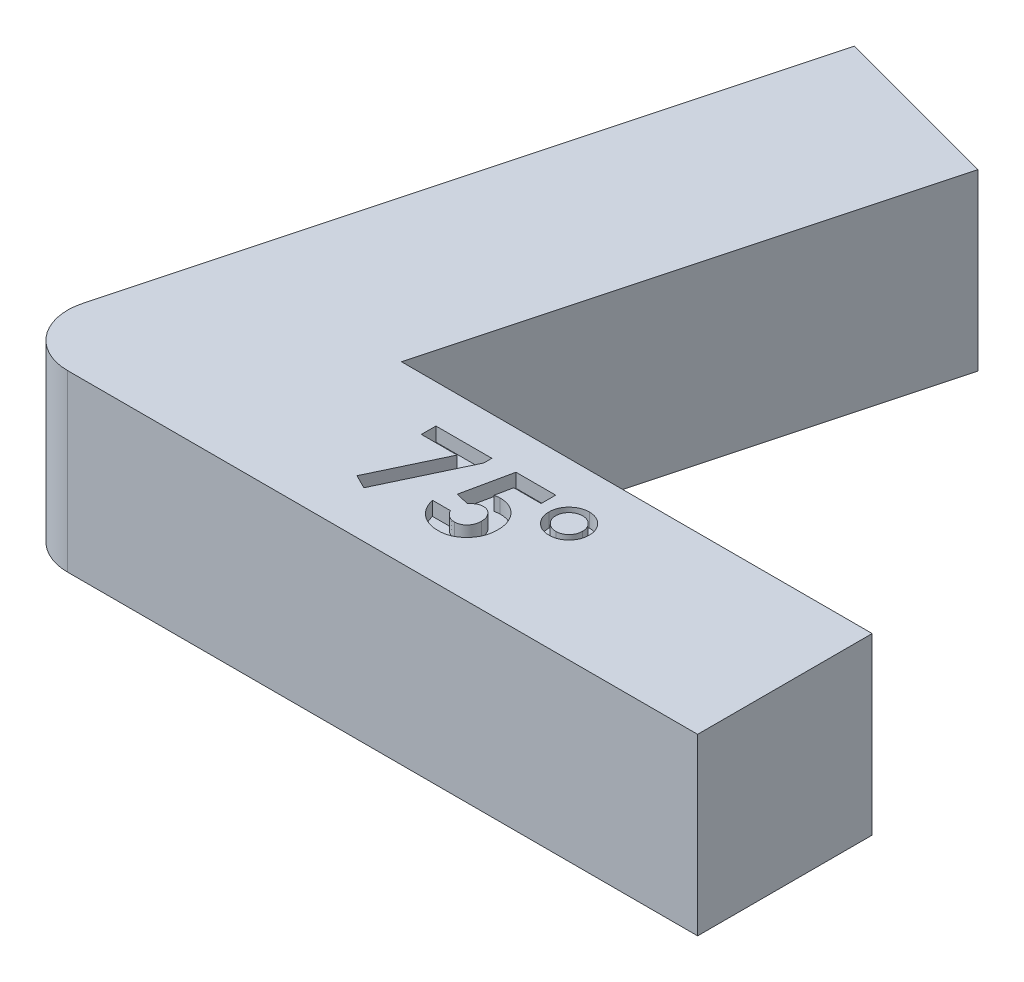
from build123d import *

# Parameters (mm, degrees)
BOSS_EXTRUDE1_DEPTH = 10
CUT_EXTRUDE1_DEPTH  = 0.8
FILLET1_R           = 3


with BuildPart() as part:
    # Sketch1 → Boss-Extrude1 (new body)
    with BuildSketch(Plane(origin=(0, 0, 0), x_dir=(1, 0, 0), z_dir=(0, 1, 0))):
        Polygon((0, 0), (10.352761804, 38.637033052), (20.012020067, 36.048842601), (13.032253728, 10), (40, 10), (40, 0), align=None)
    extrude(amount=BOSS_EXTRUDE1_DEPTH)

    # Sketch2 → Cut-Extrude1 (cut)
    # profile 1 of 3: a face of its own
    with BuildSketch(Plane(origin=(0, 10, 0), x_dir=(1, 0, 0), z_dir=(0, 1, 0))):
        Polygon((17.209062597, 7.800304966), (20.414190802, 7.800304966), (20.414190802, 7.334559774), (18.208661956, 2.672099838), (17.41338952, 3.072740864), (19.256338238, 6.966971633), (17.209062597, 6.966971633), align=None)
    # profile 2 of 3: a face of its own
    with BuildSketch(Plane(origin=(0, 10, 0), x_dir=(1, 0, 0), z_dir=(0, 1, 0))):
        with BuildLine():
            Line((21.791394328, 7.800304966), (24.068036956, 7.800304966))
            Line((24.068036956, 7.800304966), (24.068036956, 6.966971633))
            Line((24.068036956, 6.966971633), (22.502532148, 6.966971633))
            Line((22.502532148, 6.966971633), (22.307219648, 6.021458812))
            add(Edge.make_bspline(
                [(22.307219648, 6.021458812), (22.333833772, 6.028871182), (22.386322293, 6.043489897), (22.465396314, 6.058150619), (22.542030061, 6.067653234), (22.592316657, 6.068920756), (22.61671484, 6.069535735)],
                knots=[0, 0, 0, 0, 1.05461699, 2.079921384, 3.068411212, 4, 4, 4, 4], degree=3))
            add(Edge.make_bspline(
                [(22.61671484, 6.069535735), (22.669881037, 6.068317463), (22.774683324, 6.065915979), (22.927995769, 6.043118066), (23.074801493, 6.007212044), (23.214651253, 5.956002648), (23.347408434, 5.889352297), (23.473233965, 5.808724056), (23.592282275, 5.713976312), (23.702438566, 5.605049745), (23.803654767, 5.485445908), (23.89165648, 5.356081703), (23.966815436, 5.218801737), (24.02659427, 5.072752682), (24.073776823, 4.918851823), (24.107871989, 4.757000537), (24.128034164, 4.587007005), (24.13075291, 4.471032572), (24.13213952, 4.411883492)],
                knots=[0, 0, 0, 0, 1.01440847, 1.999622559, 2.951875003, 3.895578053, 4.836219714, 5.782137149, 6.743708247, 7.735272588, 8.734977101, 9.730283169, 10.717124674, 11.717316708, 12.737475749, 13.78628267, 14.87096371, 16, 16, 16, 16], degree=3))
            add(Edge.make_bspline(
                [(24.13213952, 4.411883492), (24.13044506, 4.352062933), (24.127101396, 4.234019483), (24.105287051, 4.060453858), (24.066784339, 3.894217172), (24.013897012, 3.734864413), (23.944221345, 3.583566786), (23.860426819, 3.438756962), (23.761096694, 3.301509816), (23.647205741, 3.173232299), (23.523391335, 3.055984185), (23.39155822, 2.952840795), (23.252632563, 2.866046468), (23.106611012, 2.795901979), (22.95433134, 2.740404907), (22.795747327, 2.700005688), (22.630088277, 2.67683898), (22.517627305, 2.673696911), (22.46046484, 2.672099838)],
                knots=[0, 0, 0, 0, 1.06808661, 2.107647099, 3.116961351, 4.110378221, 5.100014249, 6.085620622, 7.093190682, 8.119403071, 9.144090782, 10.133780668, 11.103064255, 12.062861538, 13.020824475, 13.992378307, 14.979551724, 16, 16, 16, 16], degree=3))
            add(Edge.make_bspline(
                [(22.46046484, 2.672099838), (22.40934615, 2.673406343), (22.308529394, 2.675983045), (22.160030738, 2.691820813), (22.016861544, 2.719822135), (21.879781883, 2.760347298), (21.747349448, 2.810224522), (21.621095195, 2.872605417), (21.500325337, 2.946302167), (21.385382813, 3.029969803), (21.278135276, 3.12421815), (21.180251089, 3.227389204), (21.091137648, 3.338182545), (21.012701841, 3.457965025), (20.94518954, 3.586559674), (20.885318255, 3.722450972), (20.836313008, 3.86705806), (20.811444257, 3.967307727), (20.798806187, 4.018253684)],
                knots=[0, 0, 0, 0, 1.054957082, 2.080596141, 3.077793124, 4.061112343, 5.027190972, 5.994718051, 6.962465889, 7.943658696, 8.924948258, 9.904494768, 10.875059, 11.855380583, 12.854004648, 13.869083016, 14.917087635, 16, 16, 16, 16], degree=3))
            Line((20.798806187, 4.018253684), (21.824447212, 4.018253684))
            add(Edge.make_bspline(
                [(21.824447212, 4.018253684), (21.843195955, 3.982950211), (21.879631997, 3.914341939), (21.948941404, 3.823254149), (22.026528884, 3.745578396), (22.111694558, 3.680555769), (22.204990244, 3.631841924), (22.302614321, 3.594899597), (22.405793198, 3.573551995), (22.476062568, 3.570883333), (22.511546571, 3.569535735)],
                knots=[0, 0, 0, 0, 1.104910296, 2.147267069, 3.153527244, 4.136738762, 5.099945312, 6.05603338, 7.018353, 8, 8, 8, 8], degree=3))
            add(Edge.make_bspline(
                [(22.511546571, 3.569535735), (22.536278445, 3.570466263), (22.584938824, 3.572297092), (22.656632197, 3.581982635), (22.725066672, 3.600326836), (22.790751041, 3.625729288), (22.853861751, 3.657409016), (22.913494087, 3.697402609), (22.970685545, 3.743436716), (23.024565438, 3.79626101), (23.073365091, 3.855147811), (23.116157049, 3.918425693), (23.15441896, 3.984688608), (23.182760143, 4.056561396), (23.205969175, 4.13189791), (23.223061245, 4.211266437), (23.233275684, 4.294759672), (23.234221268, 4.351758164), (23.234703623, 4.380833812)],
                knots=[0, 0, 0, 0, 0.978869489, 1.925942215, 2.855067702, 3.774946051, 4.70828698, 5.642468714, 6.60995405, 7.609372294, 8.622401667, 9.629904756, 10.629323, 11.642352373, 12.678539694, 13.745912462, 14.850161547, 16, 16, 16, 16], degree=3))
            add(Edge.make_bspline(
                [(23.234703623, 4.380833812), (23.234143795, 4.409234549), (23.233054076, 4.464517273), (23.224039706, 4.545692113), (23.207913173, 4.622712346), (23.185940632, 4.696167889), (23.157813157, 4.765612684), (23.123439502, 4.8314601), (23.08267282, 4.893377303), (23.035294242, 4.950103719), (22.984770214, 5.002134801), (22.930491174, 5.04764077), (22.872946146, 5.085407566), (22.813923272, 5.118379077), (22.75106657, 5.142375024), (22.685789435, 5.158900148), (22.618160515, 5.171025618), (22.572032297, 5.171738034), (22.548605866, 5.172099838)],
                knots=[0, 0, 0, 0, 1.166249705, 2.270133367, 3.348514167, 4.393962215, 5.415026464, 6.420877785, 7.440098956, 8.453121383, 9.451844239, 10.415694839, 11.355045125, 12.27538808, 13.187007209, 14.108269027, 15.039275622, 16, 16, 16, 16], degree=3))
            add(Edge.make_bspline(
                [(22.548605866, 5.172099838), (22.523159318, 5.171134283), (22.472158976, 5.169199103), (22.396385233, 5.153453063), (22.321525111, 5.127970064), (22.24716231, 5.092812228), (22.174035011, 5.046801715), (22.100213347, 4.992836657), (22.028168288, 4.926995983), (21.982360036, 4.877957699), (21.958661956, 4.85258862)],
                knots=[0, 0, 0, 0, 0.88288272, 1.769486374, 2.674910571, 3.623812639, 4.617874466, 5.670434592, 6.794841017, 8, 8, 8, 8], degree=3))
            Line((21.958661956, 4.85258862), (21.203453623, 5.025865864))
            Line((21.203453623, 5.025865864), (21.791394328, 7.800304966))
        make_face()
    # profile 3 of 3: a face of its own
    with BuildSketch(Plane(origin=(0, 10, 0), x_dir=(1, 0, 0), z_dir=(0, 1, 0))):
        with BuildLine():
            add(Edge.make_bspline(
                [(27.016754905, 6.77466394), (27.015894283, 6.734881546), (27.014201854, 6.656648682), (26.997771461, 6.541481746), (26.970245138, 6.431473064), (26.934952781, 6.325023696), (26.885915377, 6.224878251), (26.82786538, 6.128814052), (26.757788474, 6.038620111), (26.679658873, 5.953225124), (26.593831845, 5.875430334), (26.502665929, 5.806687541), (26.405880134, 5.749759137), (26.305545047, 5.702089445), (26.200298725, 5.665923631), (26.090919318, 5.640163415), (25.976947034, 5.623271754), (25.899361389, 5.621645065), (25.859903943, 5.620817787)],
                knots=[0, 0, 0, 0, 1.048753193, 2.062393874, 3.059725798, 4.03711221, 5.013824111, 5.993903926, 6.992478922, 8.020738441, 9.043061753, 10.043343452, 11.026424807, 11.999358773, 12.968420071, 13.955122655, 14.960044262, 16, 16, 16, 16], degree=3))
            add(Edge.make_bspline(
                [(25.859903943, 5.620817787), (25.820443576, 5.621636896), (25.742852188, 5.62324752), (25.628921614, 5.64025585), (25.519280645, 5.665611135), (25.414498681, 5.703408559), (25.314081611, 5.750417893), (25.218150451, 5.807769301), (25.127554897, 5.876710473), (25.042544183, 5.95498047), (24.964552308, 6.040659162), (24.896244789, 6.132270038), (24.837247617, 6.228296359), (24.791749475, 6.330843553), (24.753781599, 6.437040619), (24.728520494, 6.548716204), (24.711441335, 6.664961163), (24.709866564, 6.744217332), (24.709062597, 6.784679966)],
                knots=[0, 0, 0, 0, 1.037227242, 2.039512271, 3.023626077, 3.993053151, 4.963434463, 5.936395473, 6.927031705, 7.952593414, 8.972234493, 9.969891786, 10.954906455, 11.929570282, 12.915563215, 13.916770353, 14.936449251, 16, 16, 16, 16], degree=3))
            add(Edge.make_bspline(
                [(24.709062597, 6.784679966), (24.709900633, 6.823468957), (24.711548119, 6.899723829), (24.728338099, 7.012128405), (24.754985163, 7.120325334), (24.79335925, 7.2239599), (24.842311977, 7.322875548), (24.899871209, 7.418830503), (24.971119593, 7.508689251), (25.050523829, 7.594439997), (25.137606055, 7.672687073), (25.230040903, 7.74133655), (25.326891863, 7.798688839), (25.427502253, 7.845963386), (25.532015419, 7.883528753), (25.641239581, 7.909215552), (25.754215466, 7.925957051), (25.831131246, 7.927654213), (25.869919969, 7.928510094)],
                knots=[0, 0, 0, 0, 1.027628768, 2.020204677, 3.0054932, 3.977172113, 4.942988595, 5.928118098, 6.937247537, 7.976812879, 9.023474825, 10.036014018, 11.024160528, 12.002107364, 12.979092523, 13.962271943, 14.972371232, 16, 16, 16, 16], degree=3))
            add(Edge.make_bspline(
                [(25.869919969, 7.928510094), (25.908712096, 7.927676701), (25.985303851, 7.926031236), (26.097907413, 7.90907478), (26.206547795, 7.883705523), (26.310352951, 7.845945721), (26.409942105, 7.79864863), (26.5056646, 7.741575803), (26.596309456, 7.672658482), (26.681226911, 7.594005167), (26.760332553, 7.50903487), (26.828300411, 7.41719711), (26.887391621, 7.32184076), (26.93408392, 7.22101885), (26.97197395, 7.116301687), (26.997424214, 7.006326693), (27.014259523, 6.892039602), (27.015916035, 6.814121976), (27.016754905, 6.77466394)],
                knots=[0, 0, 0, 0, 1.02774298, 2.029191086, 3.012479778, 3.981238486, 4.951290381, 5.931946007, 6.930416638, 7.964088953, 8.997761269, 10.003308488, 10.98854748, 11.966603007, 12.943696749, 13.935593372, 14.954569896, 16, 16, 16, 16], degree=3))
        make_face()
        with BuildLine():
            add(Edge.make_bspline(
                [(26.63213952, 6.769655928), (26.631770522, 6.796413399), (26.63104301, 6.849168134), (26.619039676, 6.926470185), (26.602492138, 7.001061375), (26.578402231, 7.072272433), (26.547318359, 7.139861831), (26.508378663, 7.203540944), (26.463689271, 7.26469052), (26.411631138, 7.32142144), (26.354773459, 7.372657544), (26.295936719, 7.419864117), (26.232257492, 7.457797965), (26.165878364, 7.488483149), (26.097314087, 7.514765093), (26.025018876, 7.530554887), (25.950133714, 7.542901814), (25.899022687, 7.543559094), (25.872924776, 7.54389471)],
                knots=[0, 0, 0, 0, 1.061377507, 2.092600128, 3.099240629, 4.0928758, 5.071628549, 6.047053269, 7.052033583, 8.074955974, 9.097878365, 10.089742981, 11.0651677, 12.031904106, 12.992438743, 13.973254576, 14.965119192, 16, 16, 16, 16], degree=3))
            add(Edge.make_bspline(
                [(25.872924776, 7.54389471), (25.846499615, 7.543515076), (25.794075531, 7.542761932), (25.717463939, 7.530795566), (25.6432497, 7.514617591), (25.573077953, 7.488369614), (25.504368292, 7.458424798), (25.440434518, 7.417877084), (25.377464679, 7.373647803), (25.320691252, 7.320216014), (25.267092937, 7.263814168), (25.221464273, 7.202551601), (25.181808333, 7.139108472), (25.149335524, 7.072372515), (25.124702451, 7.002383581), (25.106078726, 6.929736813), (25.096456059, 6.854046486), (25.094613747, 6.802731548), (25.093677982, 6.776667146)],
                knots=[0, 0, 0, 0, 1.04110597, 2.065418807, 3.052483904, 4.031345003, 5.015506832, 6.002484077, 7.011358201, 8.046031082, 9.071020927, 10.07714091, 11.052896618, 12.018827533, 12.997688631, 13.975042629, 14.971463175, 16, 16, 16, 16], degree=3))
            add(Edge.make_bspline(
                [(25.093677982, 6.776667146), (25.094611351, 6.750935254), (25.096448659, 6.700282839), (25.106102664, 6.625601172), (25.124618133, 6.553898294), (25.149878668, 6.484546214), (25.181322787, 6.417103621), (25.222628494, 6.354074498), (25.268628619, 6.292082166), (25.32229926, 6.23404516), (25.380377378, 6.180470539), (25.442575043, 6.133725576), (25.507048741, 6.093655519), (25.574743318, 6.061562461), (25.644448188, 6.036219389), (25.716866773, 6.017877698), (25.792536321, 6.0081998), (25.843854115, 6.00636508), (25.869919969, 6.005433171)],
                knots=[0, 0, 0, 0, 1.017878107, 2.003660885, 2.970612419, 3.939454555, 4.919652619, 5.904816436, 6.913406512, 7.969270601, 9.02513469, 10.033724766, 11.041277553, 12.021475617, 12.990317753, 13.970071221, 14.968938047, 16, 16, 16, 16], degree=3))
            add(Edge.make_bspline(
                [(25.869919969, 6.005433171), (25.895649088, 6.006373228), (25.946296046, 6.0082237), (26.021017399, 6.017781967), (26.092159825, 6.036543355), (26.161386151, 6.060194806), (26.226980026, 6.092838856), (26.291053849, 6.13067556), (26.350750095, 6.177298935), (26.407543953, 6.229295276), (26.460792461, 6.285239766), (26.505265716, 6.347092368), (26.545000531, 6.410202172), (26.577526071, 6.476497751), (26.600843383, 6.546136059), (26.619935322, 6.617866333), (26.629273847, 6.692958119), (26.631178311, 6.743929826), (26.63213952, 6.769655928)],
                knots=[0, 0, 0, 0, 1.030660162, 2.028821957, 3.007916034, 3.971836568, 4.952298414, 5.935762656, 6.946377494, 7.977730887, 9.018140113, 10.031403548, 11.021837986, 12.002299832, 12.978835615, 13.957929692, 14.969339838, 16, 16, 16, 16], degree=3))
        make_face(mode=Mode.SUBTRACT)
    extrude(amount=-CUT_EXTRUDE1_DEPTH, mode=Mode.SUBTRACT)

    # Fillet1
    fillet1_edges = [part.edges().sort_by_distance(p)[0] for p in [
        (0, 5, 0),
    ]]
    fillet(fillet1_edges, radius=FILLET1_R)


solid = part.part
